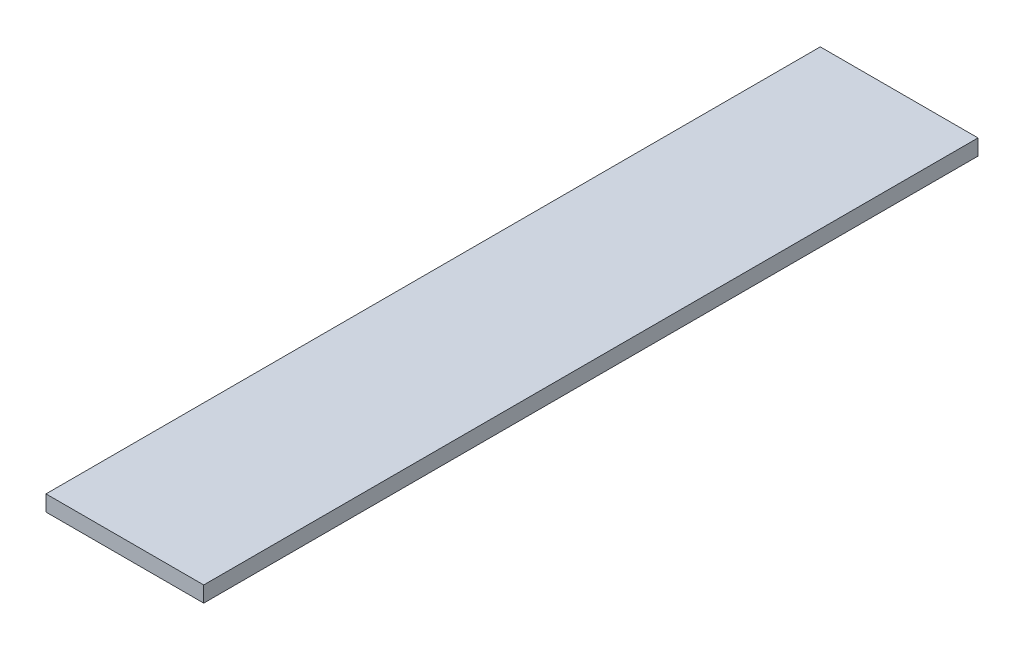
from build123d import *

# Parameters (mm, degrees)
SZKIC1_W                    = 50
SZKIC1_H                    = 5
DODANIE_WYCI_GNI_CIE1_DEPTH = 245.45


with BuildPart() as part:
    # Szkic1 → Dodanie-wyciągnięcie1 (new body)
    with BuildSketch(Plane.XY):
        with Locations((25, 2.5)):
            Rectangle(SZKIC1_W, SZKIC1_H)
    extrude(amount=DODANIE_WYCI_GNI_CIE1_DEPTH)


solid = part.part
